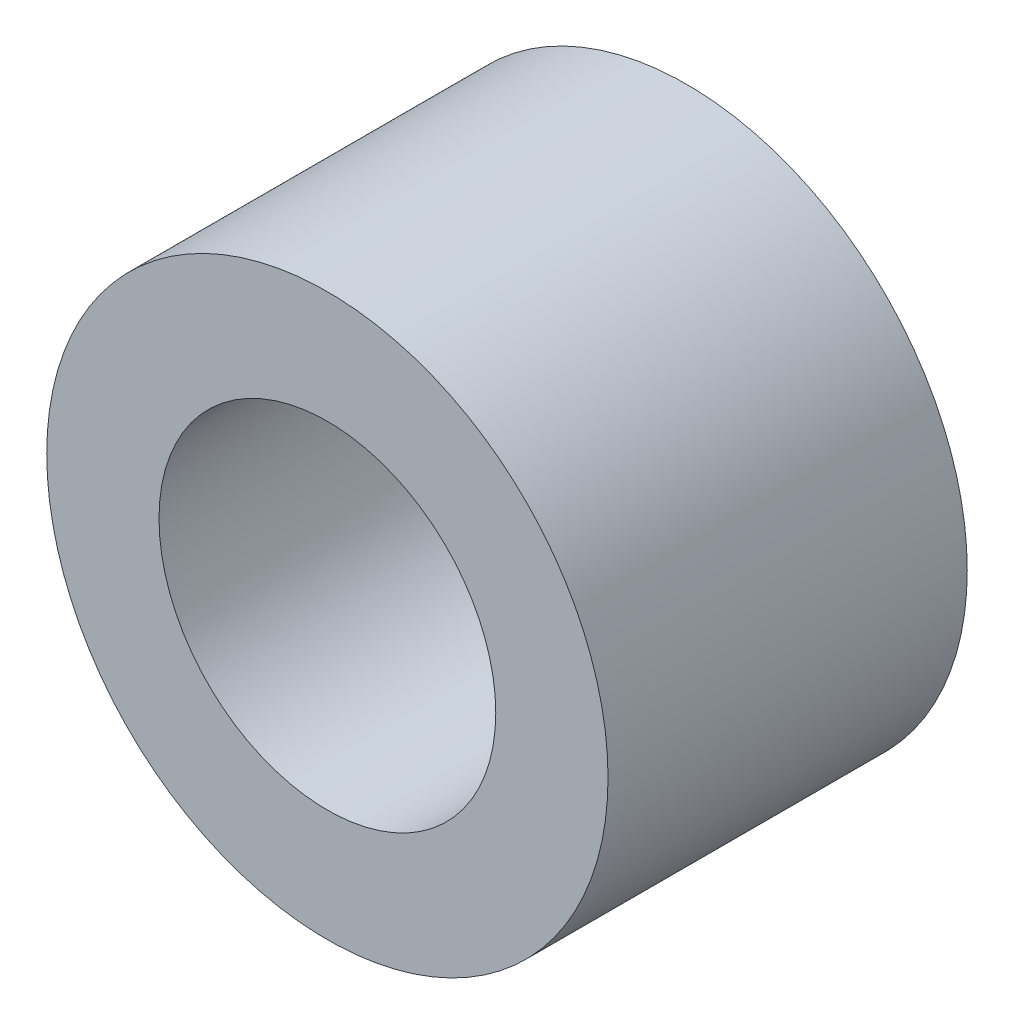
from build123d import *

# Parameters (mm, degrees)
SKETCH1_R      = 2.5
SKETCH1_R_2    = 1.5
EXTRUDE1_DEPTH = 3.2


with BuildPart() as part:
    # Sketch1 → Extrude1 (new body)
    with BuildSketch(Plane.XY):
        Circle(SKETCH1_R)
        Circle(SKETCH1_R_2, mode=Mode.SUBTRACT)
    extrude(amount=EXTRUDE1_DEPTH)


solid = part.part
